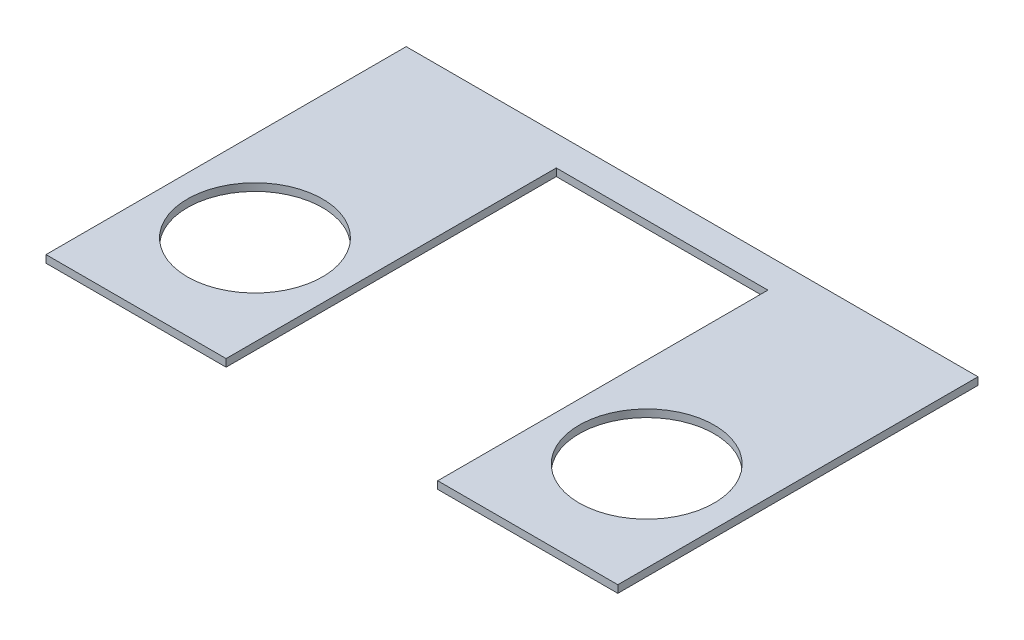
from build123d import *

# Parameters (mm, degrees)
SKETCH1_W           = 381
SKETCH1_H           = 240
BOSS_EXTRUDE1_DEPTH = 5
SKETCH2_R           = 45
CUT_EXTRUDE1_DEPTH  = 5
SKETCH5_W           = 141
SKETCH5_H           = 220
CUT_EXTRUDE3_DEPTH  = 5


with BuildPart() as part:
    # Sketch1 → Boss-Extrude1 (new body)
    with BuildSketch(Plane(origin=(0, 0, 0), x_dir=(1, 0, 0), z_dir=(0, 1, 0))):
        with Locations((-9.5, 0)):
            Rectangle(SKETCH1_W, SKETCH1_H)
    extrude(amount=BOSS_EXTRUDE1_DEPTH)

    # Sketch2 → Cut-Extrude1 (cut)
    with BuildSketch(Plane(origin=(0, 5, 0), x_dir=(1, 0, 0), z_dir=(0, 1, 0))):
        with Locations(Location((-140, -40.75, 0), (0, 0, 270))):
            Circle(SKETCH2_R)
        with Locations(Location((121, -40.75, 0), (0, 0, 270))):
            Circle(SKETCH2_R)
    extrude(amount=-CUT_EXTRUDE1_DEPTH, mode=Mode.SUBTRACT)

    # Sketch5 → Cut-Extrude3 (cut)
    with BuildSketch(Plane(origin=(0, 5, 0), x_dir=(1, 0, 0), z_dir=(0, 1, 0))):
        with Locations((-9.5, -10)):
            Rectangle(SKETCH5_W, SKETCH5_H)
    extrude(amount=-CUT_EXTRUDE3_DEPTH, mode=Mode.SUBTRACT)


solid = part.part
